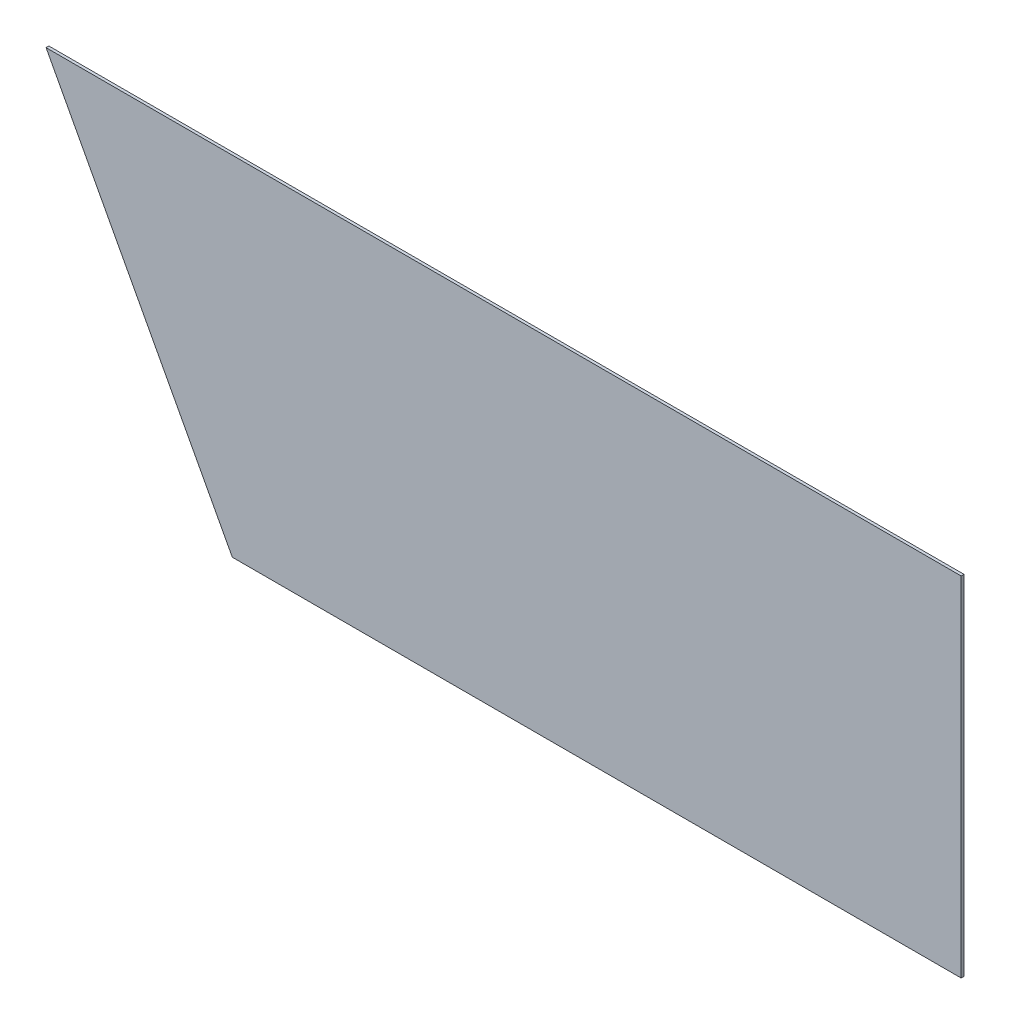
from build123d import *

# Parameters (mm, degrees)
RESSALTO_EXTRUS_O1_DEPTH = 0.035


with BuildPart() as part:
    # Esboço1 → Ressalto-extrusão1 (new body)
    with BuildSketch(Plane.XY):
        Polygon((-5.65, 2.15), (-3.35, -2.15), (5.65, -2.15), (5.65, 2.15), align=None)
    extrude(amount=RESSALTO_EXTRUS_O1_DEPTH)


solid = part.part
